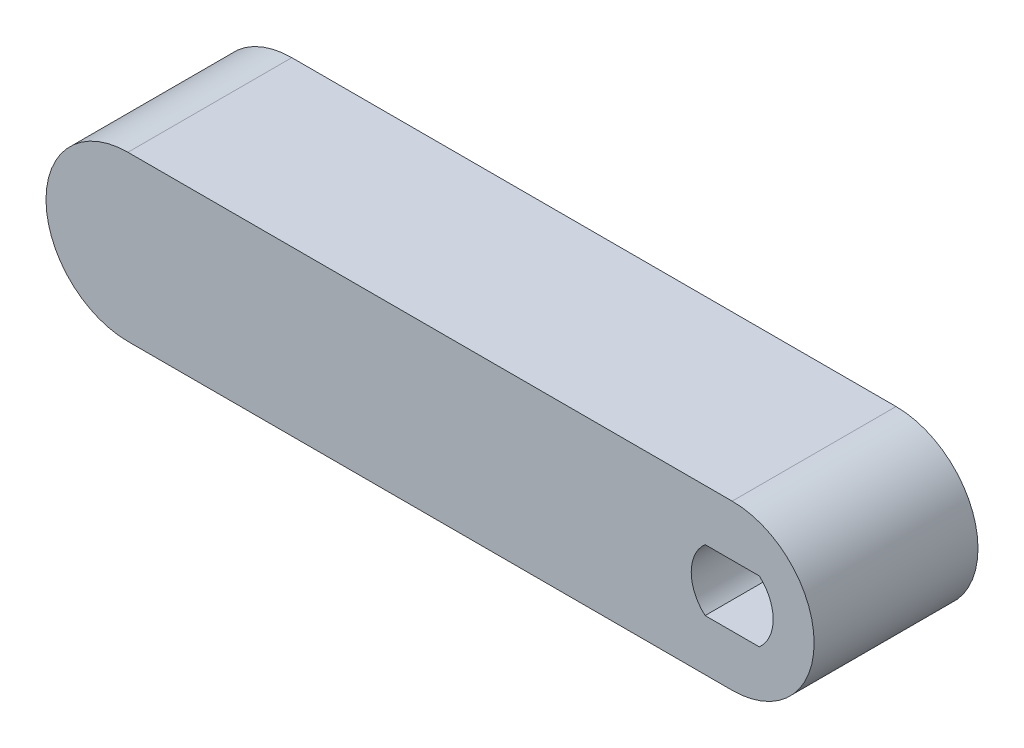
from build123d import *

# Parameters (mm, degrees)
SKETCH1_R           = 8
SKETCH1_R_2         = 4
BOSS_EXTRUDE1_DEPTH = 16


with BuildPart() as part:
    # Sketch1 → Boss-Extrude1 (new body)
    # profile 1 of 5: a face of its own
    with BuildSketch(Plane.XY):
        with Locations((-59, 0)):
            Circle(SKETCH1_R)
    # profile 2 of 5: a face of its own
    with BuildSketch(Plane.XY):
        with BuildLine():
            ThreePointArc((0, -8), (-8, 0), (0, 8))
            Line((0, 8), (-59, 8))
            ThreePointArc((-59, 8), (-53.343145751, 5.656854249), (-51, 0))
            ThreePointArc((-51, 0), (-53.343145751, -5.656854249), (-59, -8))
            Line((-59, -8), (0, -8))
        make_face()
    # profile 3 of 5: a face of its own
    with BuildSketch(Plane.XY):
        Circle(SKETCH1_R)
        Circle(SKETCH1_R_2, mode=Mode.SUBTRACT)
    # profile 4 of 5: a face of its own
    with BuildSketch(Plane.XY):
        with BuildLine():
            Line((-2.645751311, 3), (2.645751311, 3))
            ThreePointArc((2.645751311, 3), (0, 4), (-2.645751311, 3))
        make_face()
    # profile 5 of 5: a face of its own
    with BuildSketch(Plane.XY):
        with BuildLine():
            ThreePointArc((-2.645751311, -3), (0, -4), (2.645751311, -3))
            Line((2.645751311, -3), (-2.645751311, -3))
        make_face()
    extrude(amount=-BOSS_EXTRUDE1_DEPTH)


solid = part.part
